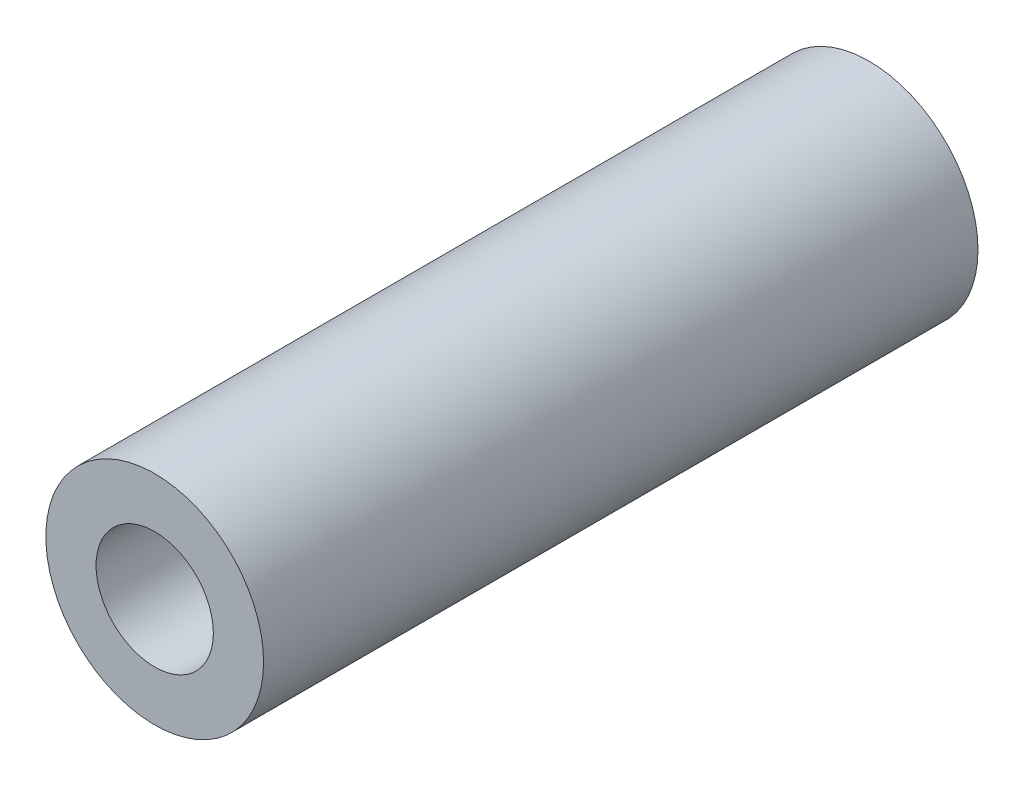
from build123d import *

# Parameters (mm, degrees)
SKETCH2_R           = 4.7625
SKETCH2_R_2         = 2.5654
BOSS_EXTRUDE1_DEPTH = 31.2547


with BuildPart() as part:
    # Sketch2 → Boss-Extrude1 (new body)
    with BuildSketch(Plane.XY):
        Circle(SKETCH2_R)
        Circle(SKETCH2_R_2, mode=Mode.SUBTRACT)
    extrude(amount=BOSS_EXTRUDE1_DEPTH)


solid = part.part
